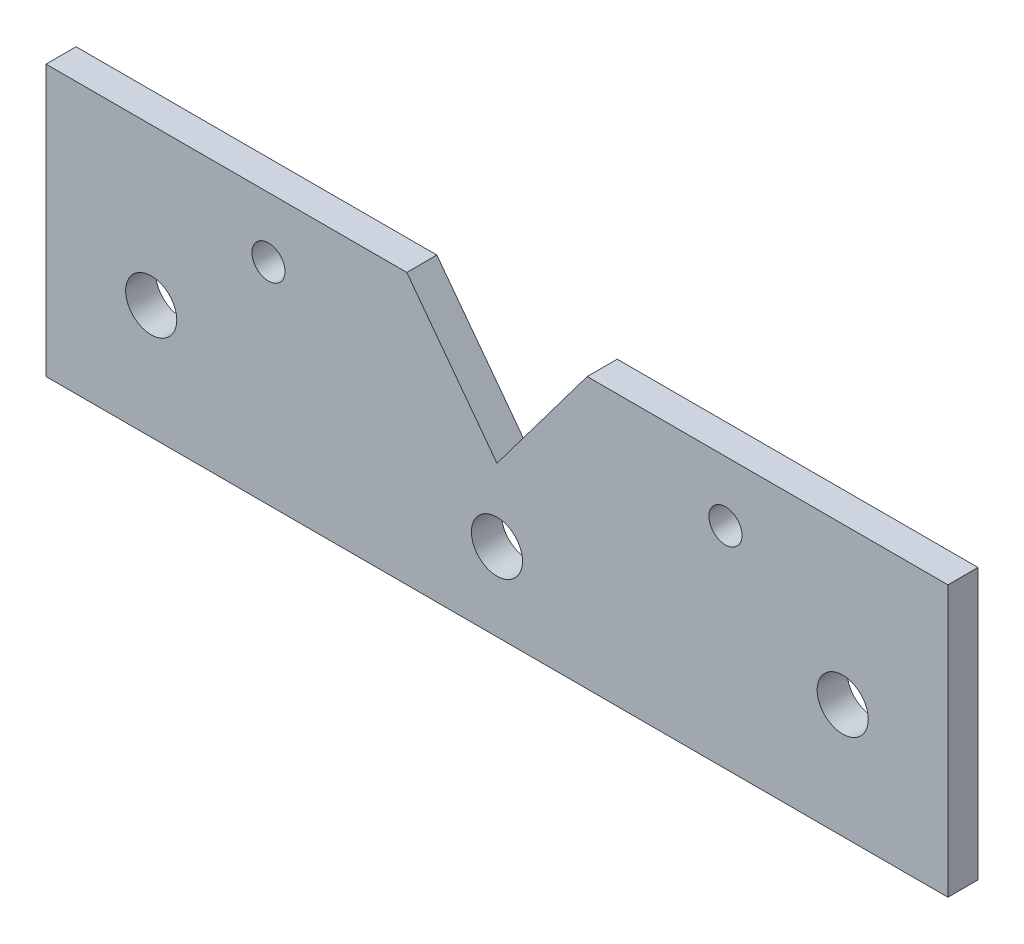
from build123d import *

# Parameters (mm, degrees)
SKETCH1_R           = 4.25
SKETCH1_R_2         = 2.75
BOSS_EXTRUDE1_DEPTH = 5


with BuildPart() as part:
    # Sketch1 → Boss-Extrude1 (new body)
    with BuildSketch(Plane.XY):
        Polygon((-127.499192618, 23.526116329), (-127.499192618, 68.526116329), (-67.499192618, 68.526116329), (-52.499192618, 48.526116329), (-37.499192618, 68.526116329), (22.500807382, 68.526116329), (22.500807382, 23.526116329), align=None)
        with Locations((-109.999192618, 42.526116329)):
            Circle(SKETCH1_R, mode=Mode.SUBTRACT)
        with Locations((5.000807382, 42.526116329)):
            Circle(SKETCH1_R, mode=Mode.SUBTRACT)
        with Locations((-52.499192618, 36.526116329)):
            Circle(SKETCH1_R, mode=Mode.SUBTRACT)
        with Locations((-90.499192618, 58.526116329)):
            Circle(SKETCH1_R_2, mode=Mode.SUBTRACT)
        with Locations((-14.499192618, 58.526116329)):
            Circle(SKETCH1_R_2, mode=Mode.SUBTRACT)
    extrude(amount=BOSS_EXTRUDE1_DEPTH)


solid = part.part
